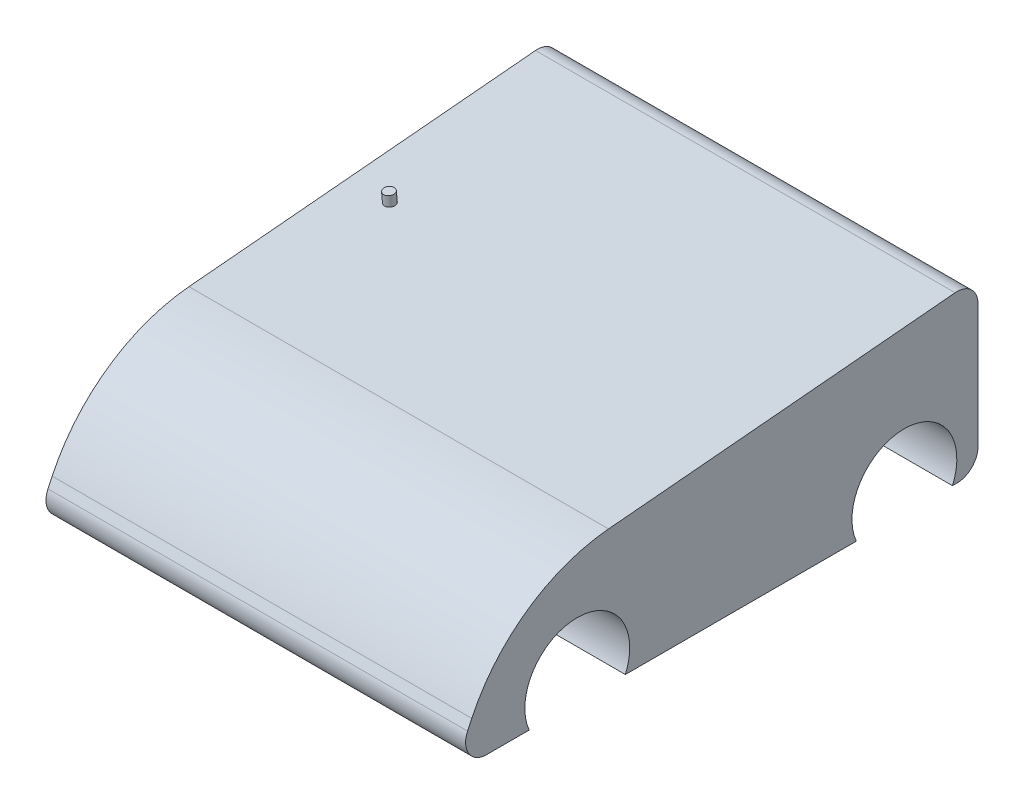
from build123d import *

# Parameters (mm, degrees)
BOSS_EXTRUDE1_DEPTH = 100
SKETCH3_R           = 25
CUT_EXTRUDE1_DEPTH  = 50
SKETCH4_R           = 2.5
BOSS_EXTRUDE2_DEPTH = 5


with BuildPart() as part:
    # Sketch2 → Boss-Extrude1 (new, symmetric)
    with BuildSketch(Plane(origin=(0, 0, 0), x_dir=(0, 0, -1), z_dir=(1, 0, 0))):
        with BuildLine():
            Line((-112.643906845, 14.257821235), (-110.645286598, 18.505070953))
            ThreePointArc((-110.645286598, 18.505070953), (-84.118524888, 49.993435328), (-45.444881226, 64.119137564))
            Line((-45.444881226, 64.119137564), (119.748610721, 79.017143226))
            ThreePointArc((119.748610721, 79.017143226), (127.392850703, 76.439367824), (130.646817248, 69.057563665))
            Line((130.646817248, 69.057563665), (130.646817248, 10))
            ThreePointArc((130.646817248, 10), (127.71788506, 2.928932188), (120.646817248, 0))
            Line((120.646817248, 0), (-103.595649647, 0))
            ThreePointArc((-103.595649647, 0), (-112.038937287, 4.641745263), (-112.643906845, 14.257821235))
        make_face()
    extrude(amount=BOSS_EXTRUDE1_DEPTH, both=True)

    # Sketch3 → Cut-Extrude1 (cut)
    with BuildSketch(Plane(origin=(100, 0, 0), x_dir=(0, 0, -1), z_dir=(1, 0, 0))):
        with Locations((-60.35749377, 10)):
            Circle(SKETCH3_R)
        with Locations((95.561704497, 10)):
            Circle(SKETCH3_R)
    cut_extrude1 = extrude(amount=-CUT_EXTRUDE1_DEPTH, mode=Mode.SUBTRACT)

    # Mirror1: Cut-Extrude1 across plane
    add(cut_extrude1.mirror(Plane(origin=(0, 0, 0), x_dir=(0, 0, 1), z_dir=(1, 0, 0))), mode=Mode.SUBTRACT)

    # Sketch4 → Boss-Extrude2 (add)
    with BuildSketch(Plane(origin=(0, 67.667230134, 6.102581681), x_dir=(1, 0, 0), z_dir=(0, 0.9959579561140941, 0.0898206527088083))):
        with Locations(Location((-80, 36.574402855, 0), (0, 0, 90))):
            Circle(SKETCH4_R)
    extrude(amount=BOSS_EXTRUDE2_DEPTH)


solid = part.part
